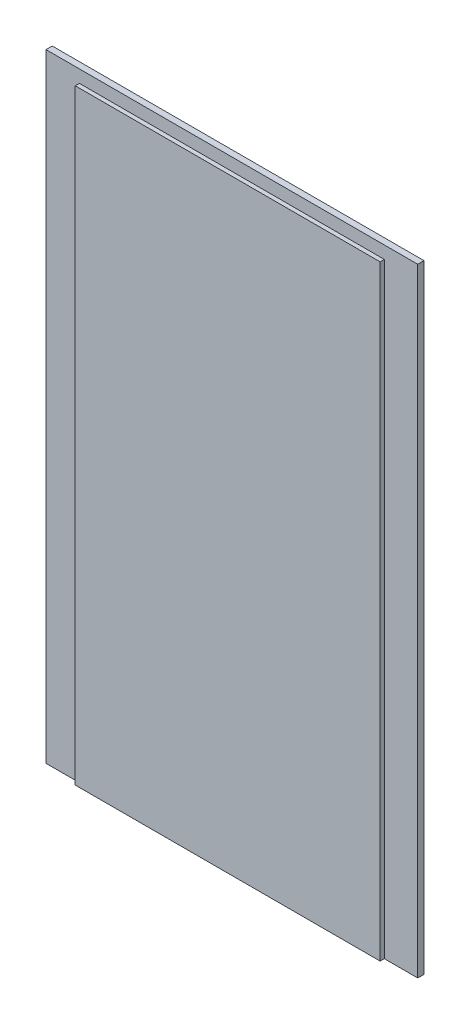
from build123d import *

# Parameters (mm, degrees)
EXTRUDE_1_DEPTH = 145
SKETCH_6_W      = 89
SKETCH_6_H      = 1.5
EXTRUDE_2_DEPTH = 3
SKETCH_7_W      = 0.897435897
SKETCH_7_H      = 3.5
SKETCH_7_W_2    = 0.897435898
EXTRUDE_3_DEPTH = 3


with BuildPart() as part:
    # Эскиз5 → Бобышка-Вытянуть1 (new body)
    with BuildSketch(Plane(origin=(0, 0, 0), x_dir=(1, 0, 0), z_dir=(0, 1, 0))):
        Polygon((36.5, 3.5), (-36.5, 3.5), (-36.5, 2.5), (-44.5, 2.5), (-44.5, 1), (-36.5, 1), (-36.5, 0), (36.5, 0), (36.5, 1), (44.5, 1), (44.5, 2.5), (36.5, 2.5), align=None)
    extrude(amount=EXTRUDE_1_DEPTH)

    # Эскиз6 → Бобышка-Вытянуть2 (add)
    with BuildSketch(Plane(origin=(0, 145, 0), x_dir=(1, 0, 0), z_dir=(0, 1, 0))):
        with Locations((0, 1.75)):
            Rectangle(SKETCH_6_W, SKETCH_6_H)
    extrude(amount=EXTRUDE_2_DEPTH)

    # Эскиз7 → Бобышка-Вытянуть3 (add)
    # profile 1 of 29: a face of its own
    with BuildSketch(Plane(origin=(0, 0, -3.5), x_dir=(-1, 0, 0), z_dir=(0, 0, -1))):
        Polygon((6.340945513, 69), (5.374098558, 69), (4.307692308, 71.44130609), (3.234975962, 69), (2.275140224, 69), (1.548076923, 72.5), (2.457431891, 72.5), (2.916666667, 70.289362981), (3.888421474, 72.5), (4.732572115, 72.5), (5.698717949, 70.289362981), (6.157251603, 72.5), (7.067307692, 72.5), align=None)
    # profile 2 of 29: a face of its own
    with BuildSketch(Plane(origin=(0, 0, -3.5), x_dir=(-1, 0, 0), z_dir=(0, 0, -1))):
        with Locations((0.336538461, 70.75)):
            Rectangle(SKETCH_7_W, SKETCH_7_H)
    # profile 3 of 29: a face of its own
    with BuildSketch(Plane(origin=(0, 0, -3.5), x_dir=(-1, 0, 0), z_dir=(0, 0, -1))):
        with BuildLine():
            Line((-1.189102564, 69), (-2.165064103, 69))
            add(Edge.make_bspline(
                [(-2.165064103, 69), (-2.228635261, 69.00020437), (-2.351357975, 69.000598903), (-2.528562634, 69.005416294), (-2.692177155, 69.013957561), (-2.842104158, 69.024639346), (-2.978162429, 69.03946478), (-3.100370519, 69.056481913), (-3.208787397, 69.077306359), (-3.304826613, 69.101873952), (-3.391368879, 69.130907486), (-3.472520026, 69.162052171), (-3.548524285, 69.198473839), (-3.61980905, 69.238774368), (-3.686789633, 69.282246677), (-3.74931433, 69.329862159), (-3.806984201, 69.381932528), (-3.859662346, 69.437885814), (-3.906236926, 69.497608324), (-3.948563722, 69.559227105), (-3.982424958, 69.625095846), (-4.011836623, 69.692975425), (-4.033059597, 69.764437317), (-4.049787365, 69.838349293), (-4.058506818, 69.915458372), (-4.060095018, 69.967763964), (-4.060897436, 69.994190705)],
                knots=[0, 0, 0, 0, 1.900408557, 3.668696642, 5.298733665, 6.798040708, 8.16136036, 9.389513719, 10.485676558, 11.460051565, 12.350426071, 13.213208427, 14.056969626, 14.867235364, 15.659807379, 16.442338586, 17.214034585, 17.980175887, 18.736345016, 19.476562789, 20.210987823, 20.946740932, 21.684878556, 22.435865721, 23.209740898, 24, 24, 24, 24], degree=3))
            add(Edge.make_bspline(
                [(-4.060897436, 69.994190705), (-4.060107465, 70.023447976), (-4.058551519, 70.081073787), (-4.045717785, 70.165504319), (-4.024375289, 70.245952319), (-3.995855212, 70.323199553), (-3.957535253, 70.396003671), (-3.911675105, 70.465653093), (-3.856683337, 70.530626699), (-3.793786521, 70.591877287), (-3.723945337, 70.648850029), (-3.647932205, 70.701910234), (-3.565279033, 70.749016356), (-3.477896321, 70.794000478), (-3.383273212, 70.831679235), (-3.283697862, 70.867282699), (-3.177800027, 70.897360113), (-3.104663932, 70.913070651), (-3.067407853, 70.921073718)],
                knots=[0, 0, 0, 0, 0.947621555, 1.86645774, 2.759084883, 3.640919322, 4.528263458, 5.418736085, 6.337853046, 7.280286935, 8.259540735, 9.255198587, 10.279917928, 11.339871244, 12.43669861, 13.576668726, 14.765536754, 16, 16, 16, 16], degree=3))
            add(Edge.make_bspline(
                [(-3.067407853, 70.921073718), (-3.042673898, 70.925539616), (-2.988977895, 70.935234827), (-2.900664245, 70.945052875), (-2.798740793, 70.954048862), (-2.683038007, 70.961811102), (-2.553516703, 70.967091734), (-2.410243225, 70.971199744), (-2.25295044, 70.974201348), (-2.143564576, 70.974304959), (-2.086538462, 70.974358974)],
                knots=[0, 0, 0, 0, 0.613221355, 1.331268544, 2.167268072, 3.11042782, 4.160855784, 5.330565642, 6.608344223, 8, 8, 8, 8], degree=3))
            Line((-2.086538462, 70.974358974), (-2.086538462, 72.5))
            Line((-2.086538462, 72.5), (-1.189102564, 72.5))
            Line((-1.189102564, 72.5), (-1.189102564, 69))
        make_face()
        with BuildLine():
            Line((-2.086538462, 70.346153846), (-2.383112981, 70.346153846))
            add(Edge.make_bspline(
                [(-2.383112981, 70.346153846), (-2.411158218, 70.345962385), (-2.46514861, 70.345593799), (-2.542755585, 70.344388739), (-2.61383255, 70.341702152), (-2.678085373, 70.337300055), (-2.735666434, 70.332832713), (-2.786349517, 70.326253381), (-2.830671994, 70.319651451), (-2.879967142, 70.30874307), (-2.93381556, 70.291242699), (-2.991426546, 70.264259758), (-3.042595004, 70.232332582), (-3.085538583, 70.193476578), (-3.120296427, 70.150065849), (-3.145634353, 70.101886118), (-3.160805746, 70.049085389), (-3.162563664, 70.012285503), (-3.163461538, 69.993489583)],
                knots=[0, 0, 0, 0, 1.407758276, 2.710100819, 3.895851713, 4.977388327, 5.942821687, 6.794020387, 7.542320152, 8.191242121, 9.326416202, 10.375988675, 11.378278205, 12.341785334, 13.268824292, 14.15557569, 15.057941327, 16, 16, 16, 16], degree=3))
            add(Edge.make_bspline(
                [(-3.163461538, 69.993489583), (-3.162851565, 69.977059925), (-3.16166178, 69.945012985), (-3.150525145, 69.899015888), (-3.134033951, 69.855888178), (-3.108480768, 69.817261279), (-3.077837345, 69.780836435), (-3.038861195, 69.74964819), (-2.994613049, 69.719941175), (-2.960889693, 69.705266351), (-2.943309295, 69.697616186)],
                knots=[0, 0, 0, 0, 1.000089897, 1.950729556, 2.871637391, 3.80066878, 4.760556227, 5.762269319, 6.833443624, 8, 8, 8, 8], degree=3))
            add(Edge.make_bspline(
                [(-2.943309295, 69.697616186), (-2.928677051, 69.691964447), (-2.89711002, 69.679771605), (-2.843924022, 69.666277432), (-2.78233594, 69.654546484), (-2.712342845, 69.64495998), (-2.633994156, 69.637348407), (-2.547018318, 69.631642407), (-2.451366931, 69.629351778), (-2.384749174, 69.628597013), (-2.350160256, 69.628205128)],
                knots=[0, 0, 0, 0, 0.626675799, 1.351965855, 2.189441299, 3.132954783, 4.175220124, 5.336285959, 6.616960563, 8, 8, 8, 8], degree=3))
            Line((-2.350160256, 69.628205128), (-2.086538462, 69.628205128))
            Line((-2.086538462, 69.628205128), (-2.086538462, 70.346153846))
        make_face(mode=Mode.SUBTRACT)
    # profile 4 of 29: a face of its own
    with BuildSketch(Plane(origin=(0, 0, -3.5), x_dir=(-1, 0, 0), z_dir=(0, 0, -1))):
        Polygon((-4.46474359, 69), (-7.067307692, 69), (-7.067307692, 69.628205128), (-6.21474359, 69.628205128), (-6.21474359, 72.5), (-5.317307692, 72.5), (-5.317307692, 69.628205128), (-4.46474359, 69.628205128), align=None)
    # profile 5 of 29: a face of its own
    with BuildSketch(Plane(origin=(0, 0, -3.5), x_dir=(-1, 0, 0), z_dir=(0, 0, -1))):
        with BuildLine():
            Line((12.474358974, 76.485376603), (13.096254006, 76.92568109))
            add(Edge.make_bspline(
                [(13.096254006, 76.92568109), (13.149405771, 76.885110595), (13.254326787, 76.805024872), (13.420542505, 76.700698766), (13.592376747, 76.613664551), (13.768940381, 76.541818562), (13.950409291, 76.485314643), (14.136960119, 76.445526477), (14.328393483, 76.420840909), (14.457758288, 76.418066604), (14.523036859, 76.416666667)],
                knots=[0, 0, 0, 0, 1.038268964, 2.04953188, 3.04312578, 4.026674873, 5.007265049, 5.991276296, 6.986381084, 8, 8, 8, 8], degree=3))
            add(Edge.make_bspline(
                [(14.523036859, 76.416666667), (14.577761866, 76.417776798), (14.685350397, 76.419959298), (14.843369804, 76.436165416), (14.994732547, 76.463603018), (15.139457694, 76.501311407), (15.277709235, 76.549804263), (15.409267825, 76.609364596), (15.533745459, 76.680811684), (15.650941984, 76.761251841), (15.757195355, 76.850326721), (15.851603052, 76.944511578), (15.931587684, 77.044418502), (15.996362312, 77.150034361), (16.046956645, 77.260676137), (16.082536738, 77.376389478), (16.105287977, 77.497139047), (16.107735154, 77.579491932), (16.108974359, 77.62119391)],
                knots=[0, 0, 0, 0, 1.187810515, 2.335217395, 3.443744067, 4.524122415, 5.57827598, 6.620360632, 7.654213211, 8.689931166, 9.701932281, 10.659736972, 11.5803843, 12.473085625, 13.342609221, 14.213906934, 15.095555492, 16, 16, 16, 16], degree=3))
            add(Edge.make_bspline(
                [(16.108974359, 77.62119391), (16.108179187, 77.650423928), (16.106610477, 77.708088698), (16.097818358, 77.793326481), (16.080939724, 77.875828167), (16.060058263, 77.956402559), (16.030587763, 78.033999043), (15.995706604, 78.109150166), (15.953956132, 78.181709861), (15.906213702, 78.251646636), (15.853230107, 78.319060472), (15.793890593, 78.382112585), (15.729940026, 78.44181143), (15.661169847, 78.498248279), (15.586388321, 78.550120896), (15.506381945, 78.598281529), (15.421447675, 78.643597011), (15.331057431, 78.683404178), (15.237688824, 78.721156245), (15.140618197, 78.75197842), (15.041718523, 78.780083267), (14.939660424, 78.801141812), (14.835470835, 78.81926025), (14.728411842, 78.830487251), (14.618993655, 78.838981195), (14.545023048, 78.839487516), (14.507612179, 78.83974359)],
                knots=[0, 0, 0, 0, 0.9376715, 1.849831607, 2.74357491, 3.636311886, 4.516213089, 5.40146135, 6.291172518, 7.19758658, 8.115334337, 9.03808814, 9.971435783, 10.919652956, 11.888617217, 12.887416778, 13.913407831, 14.973546859, 16.053635784, 17.141602244, 18.238132767, 19.349523208, 20.481945609, 21.628346475, 22.800528716, 24, 24, 24, 24], degree=3))
            add(Edge.make_bspline(
                [(14.507612179, 78.83974359), (14.444454977, 78.838396222), (14.320609121, 78.835754151), (14.138857661, 78.815013237), (13.965373976, 78.781177234), (13.826359122, 78.739960985), (13.717473026, 78.699916327), (13.63440187, 78.663590392), (13.54908447, 78.622536716), (13.462032767, 78.575153818), (13.37272731, 78.522625257), (13.282113895, 78.463607715), (13.189045491, 78.399571431), (13.127212021, 78.354041028), (13.095552885, 78.330729167)],
                knots=[0, 0, 0, 0, 1.483770936, 2.909547549, 4.292426947, 5.632183673, 6.311578283, 7.017531894, 7.761751139, 8.53576674, 9.34574804, 10.195735624, 11.076204957, 12, 12, 12, 12], degree=3))
            Line((13.095552885, 78.330729167), (12.493289263, 78.799779647))
            add(Edge.make_bspline(
                [(12.493289263, 78.799779647), (12.535865916, 78.830202581), (12.619634385, 78.89005892), (12.746441515, 78.973617835), (12.872267333, 79.049044046), (12.995301011, 79.118797951), (13.116799082, 79.180905347), (13.236984169, 79.234455097), (13.354646299, 79.282932784), (13.47219216, 79.322763774), (13.590668639, 79.357874568), (13.712516947, 79.386744475), (13.838227208, 79.412402047), (13.96791673, 79.432252804), (14.101612664, 79.448800497), (14.239416278, 79.459470203), (14.381326343, 79.466998199), (14.4772198, 79.467628919), (14.525841346, 79.467948718)],
                knots=[0, 0, 0, 0, 1.151115548, 2.264790175, 3.339609904, 4.377801964, 5.375697708, 6.339873563, 7.271677484, 8.174039226, 9.068826305, 9.989098544, 10.927812609, 11.890561843, 12.874533522, 13.890697936, 14.930505465, 16, 16, 16, 16], degree=3))
            add(Edge.make_bspline(
                [(14.525841346, 79.467948718), (14.614700724, 79.4662666), (14.788773241, 79.462971387), (15.043755613, 79.439137362), (15.286299135, 79.39862166), (15.516385041, 79.342031539), (15.734050974, 79.268945495), (15.939530767, 79.179967174), (16.13258764, 79.074226564), (16.283156382, 78.973197848), (16.395493867, 78.885198364), (16.474474983, 78.816997038), (16.547707411, 78.746310925), (16.616321929, 78.673993868), (16.678867345, 78.598827771), (16.735405461, 78.521073184), (16.787030468, 78.441333389), (16.83336625, 78.359480416), (16.873866473, 78.274979174), (16.910128003, 78.188924198), (16.939274103, 78.099875627), (16.964078815, 78.008921821), (16.982652399, 77.915386385), (16.997150498, 77.819998104), (17.004597129, 77.72204171), (17.005800738, 77.656026763), (17.006410256, 77.622596154)],
                knots=[0, 0, 0, 0, 1.854242412, 3.632398211, 5.338628587, 6.981657757, 8.571767065, 10.124763514, 11.648247808, 13.15920557, 13.902647685, 14.625273405, 15.335833078, 16.025877133, 16.704660648, 17.374839119, 18.030956841, 18.686113137, 19.336148312, 19.985561112, 20.633323558, 21.289930521, 21.951823402, 22.622250278, 23.302294172, 24, 24, 24, 24], degree=3))
            add(Edge.make_bspline(
                [(17.006410256, 77.622596154), (17.005456915, 77.579556797), (17.00356531, 77.494158793), (16.988770496, 77.367881986), (16.963165616, 77.245642951), (16.928958961, 77.126741352), (16.883746709, 77.012062311), (16.829737815, 76.900342164), (16.764697183, 76.793005529), (16.690572981, 76.689238538), (16.606529887, 76.59038537), (16.514877935, 76.49556231), (16.414023267, 76.406112407), (16.30422532, 76.322475396), (16.187139919, 76.241850095), (16.060319097, 76.167734996), (15.9250815, 76.098619097), (15.782608563, 76.034454866), (15.63474017, 75.976119162), (15.482476776, 75.926963807), (15.327994579, 75.883820543), (15.170576514, 75.848434552), (15.010098129, 75.82246995), (14.846916875, 75.802223332), (14.680939976, 75.791273443), (14.569324939, 75.789402151), (14.513221154, 75.788461538)],
                knots=[0, 0, 0, 0, 0.901853117, 1.78944255, 2.659714495, 3.516835198, 4.379076333, 5.239939207, 6.114349796, 7.00597059, 7.90964393, 8.830983393, 9.767712282, 10.731677408, 11.722021095, 12.745140691, 13.807530144, 14.903594606, 16.018677386, 17.136950282, 18.255126642, 19.379240575, 20.51618145, 21.66072434, 22.824152899, 24, 24, 24, 24], degree=3))
            add(Edge.make_bspline(
                [(14.513221154, 75.788461538), (14.465064095, 75.788984737), (14.369377411, 75.790024317), (14.226483546, 75.798872128), (14.084895504, 75.812458096), (13.944684855, 75.833291948), (13.805690209, 75.858310593), (13.668021882, 75.88897265), (13.532144751, 75.926619939), (13.397659593, 75.968200301), (13.266421275, 76.015726232), (13.139347856, 76.06827703), (13.016999859, 76.12589293), (12.899319083, 76.188522438), (12.785555935, 76.254585148), (12.677327717, 76.326737398), (12.57314342, 76.402896672), (12.507260244, 76.457905735), (12.474358974, 76.485376603)],
                knots=[0, 0, 0, 0, 1.050930545, 2.088168614, 3.123536348, 4.154333288, 5.180817913, 6.20542527, 7.231212662, 8.257240971, 9.27696146, 10.276297078, 11.257425369, 12.227151396, 13.185054345, 14.127224728, 15.064758453, 16, 16, 16, 16], degree=3))
        make_face()
    # profile 6 of 29: a face of its own
    with BuildSketch(Plane(origin=(0, 0, -3.5), x_dir=(-1, 0, 0), z_dir=(0, 0, -1))):
        with BuildLine():
            add(Edge.make_bspline(
                [(9.323517628, 75.788461538), (9.24095194, 75.790017755), (9.078462855, 75.793080386), (8.839179837, 75.819073329), (8.608700132, 75.860741058), (8.386853461, 75.919794254), (8.174016879, 75.99571736), (7.969435905, 76.087725356), (7.77415525, 76.197515485), (7.619864293, 76.302421546), (7.502941431, 76.392919469), (7.420739857, 76.463041113), (7.344429822, 76.5353162), (7.273201846, 76.60895738), (7.208108423, 76.684740501), (7.148201716, 76.762034273), (7.093908597, 76.8411537), (7.046554141, 76.922916121), (7.003355998, 77.005701114), (6.9660088, 77.090604995), (6.935318175, 77.177682327), (6.910135647, 77.266493407), (6.889424191, 77.356716377), (6.875695999, 77.44908209), (6.866946203, 77.543198735), (6.865908357, 77.606684364), (6.865384615, 77.638721955)],
                knots=[0, 0, 0, 0, 1.74493956, 3.434037043, 5.081349706, 6.691931204, 8.281094076, 9.853178973, 11.428048157, 13.010685739, 13.792349565, 14.552725307, 15.293608286, 16.013370378, 16.717482666, 17.404257924, 18.079800099, 18.744084574, 19.400329141, 20.052937459, 20.702960141, 21.350349162, 22.003555586, 22.658236246, 23.322888033, 24, 24, 24, 24], degree=3))
            add(Edge.make_bspline(
                [(6.865384615, 77.638721955), (6.865920376, 77.670290692), (6.866985873, 77.733073118), (6.875626955, 77.826276535), (6.889669261, 77.917820477), (6.909177881, 78.007562343), (6.93470429, 78.095224622), (6.964672791, 78.181425628), (7.00133557, 78.265371293), (7.043365703, 78.347641521), (7.091544264, 78.427541441), (7.143848446, 78.506528913), (7.202994004, 78.58285033), (7.267883606, 78.657010724), (7.337103143, 78.730530071), (7.413303309, 78.800758513), (7.493802868, 78.870801891), (7.609801607, 78.959786424), (7.762286028, 79.064102381), (7.956486653, 79.172222411), (8.160192136, 79.263593278), (8.372945399, 79.3390939), (8.59583992, 79.395960552), (8.827645601, 79.438505448), (9.069415006, 79.463034384), (9.23371986, 79.466292953), (9.317207532, 79.467948718)],
                knots=[0, 0, 0, 0, 0.670509522, 1.333477928, 1.986463641, 2.636953425, 3.282746882, 3.924942789, 4.574218971, 5.226997055, 5.88599427, 6.555179182, 7.238360871, 7.935169854, 8.64801199, 9.382112235, 10.13545024, 10.913984185, 12.486487991, 14.055571225, 15.628803686, 17.224104116, 18.84486328, 20.510026804, 22.226651662, 24, 24, 24, 24], degree=3))
            add(Edge.make_bspline(
                [(9.317207532, 79.467948718), (9.361386892, 79.467564804), (9.448622841, 79.466806733), (9.578156772, 79.460163947), (9.704749461, 79.450161436), (9.828569746, 79.434138203), (9.949561051, 79.415633486), (10.067994883, 79.392542239), (10.183124802, 79.364233124), (10.295892462, 79.333080956), (10.40539431, 79.29616093), (10.512454741, 79.255887117), (10.616478551, 79.210769593), (10.717582573, 79.161727661), (10.81593062, 79.108147889), (10.911873047, 79.051029501), (11.004621178, 78.989041435), (11.093865421, 78.923393557), (11.179271232, 78.855139493), (11.259062049, 78.783986067), (11.33425909, 78.712272809), (11.40326693, 78.638062943), (11.467040482, 78.562581489), (11.525367595, 78.485370127), (11.578059367, 78.406733845), (11.625374156, 78.326562504), (11.666633521, 78.244505677), (11.702579477, 78.160954819), (11.732592544, 78.075814099), (11.758127155, 77.989335939), (11.777942846, 77.901074084), (11.79073971, 77.811012739), (11.799776465, 77.719533708), (11.800777017, 77.65790855), (11.801282051, 77.626802885)],
                knots=[0, 0, 0, 0, 1.237847268, 2.444236017, 3.63360164, 4.795130255, 5.941758047, 7.062951849, 8.174773718, 9.263206711, 10.340053451, 11.41157047, 12.467505574, 13.51602308, 14.55921001, 15.604799062, 16.643701838, 17.683677307, 18.708449217, 19.705842561, 20.678441117, 21.619007911, 22.543849975, 23.446255201, 24.328961177, 25.194892346, 26.052987999, 26.90082716, 27.741759166, 28.58103215, 29.426287742, 30.273696855, 31.128638194, 32, 32, 32, 32], degree=3))
            add(Edge.make_bspline(
                [(11.801282051, 77.626802885), (11.800391797, 77.585390617), (11.798620098, 77.502975925), (11.782741347, 77.380705102), (11.756575224, 77.261205371), (11.721034365, 77.143838439), (11.673146709, 77.029770388), (11.617557546, 76.916768803), (11.549507844, 76.807601929), (11.472637634, 76.701064483), (11.386228916, 76.599029382), (11.292297004, 76.50136961), (11.190317223, 76.40938267), (11.080635651, 76.323062022), (10.963194729, 76.242061533), (10.837421251, 76.16756514), (10.704761034, 76.09708828), (10.565215546, 76.033022181), (10.420219854, 75.975823779), (10.272034435, 75.925196768), (10.120542199, 75.882981987), (9.966427267, 75.849098842), (9.809825086, 75.821065724), (9.650100363, 75.802864916), (9.487789815, 75.790056574), (9.378464464, 75.788995056), (9.323517628, 75.788461538)],
                knots=[0, 0, 0, 0, 0.873460711, 1.738277099, 2.596163496, 3.452461267, 4.321456688, 5.203532137, 6.106744663, 7.031925761, 7.973272717, 8.925304006, 9.888873028, 10.868446012, 11.868274739, 12.89658803, 13.950947263, 15.036473622, 16.13434976, 17.23835449, 18.33901757, 19.450408571, 20.566700231, 21.693916212, 22.840964104, 24, 24, 24, 24], degree=3))
        make_face()
        with BuildLine():
            add(Edge.make_bspline(
                [(9.336838942, 76.416666667), (9.39110197, 76.417743258), (9.497536018, 76.419854935), (9.653814546, 76.436473033), (9.803721345, 76.462669882), (9.946963405, 76.500655317), (10.083506237, 76.549054601), (10.213412393, 76.608119737), (10.336353122, 76.678685977), (10.452091343, 76.758505788), (10.55740848, 76.846865498), (10.650326629, 76.941806876), (10.728274695, 77.043229576), (10.793344949, 77.149765933), (10.842392169, 77.263253588), (10.878395614, 77.381942044), (10.899990355, 77.506828309), (10.902545131, 77.591895666), (10.903846154, 77.635216346)],
                knots=[0, 0, 0, 0, 1.178028087, 2.310639573, 3.408615578, 4.479507672, 5.524413559, 6.550856868, 7.573693561, 8.598492218, 9.599763625, 10.554372239, 11.477031471, 12.371703975, 13.257960676, 14.153783811, 15.059811607, 16, 16, 16, 16], degree=3))
            add(Edge.make_bspline(
                [(10.903846154, 77.635216346), (10.902105714, 77.683253305), (10.898681974, 77.777750158), (10.871336289, 77.915327804), (10.826921228, 78.045489234), (10.763935651, 78.167488597), (10.682947462, 78.281676019), (10.58355008, 78.38701422), (10.467241606, 78.485418595), (10.379646882, 78.541586256), (10.334535256, 78.570512821)],
                knots=[0, 0, 0, 0, 1.002334352, 1.971761834, 2.916169619, 3.865506182, 4.828130753, 5.82934798, 6.882105733, 8, 8, 8, 8], degree=3))
            add(Edge.make_bspline(
                [(10.334535256, 78.570512821), (10.297468619, 78.592160507), (10.223185512, 78.635543385), (10.105799764, 78.689547929), (9.984814331, 78.736238222), (9.859647625, 78.77407567), (9.730544582, 78.803471911), (9.597277608, 78.824489812), (9.460024601, 78.837373433), (9.367015163, 78.838947912), (9.320012019, 78.83974359)],
                knots=[0, 0, 0, 0, 0.968643878, 1.941203282, 2.913290218, 3.894783287, 4.890638372, 5.900389362, 6.938943154, 8, 8, 8, 8], degree=3))
            add(Edge.make_bspline(
                [(9.320012019, 78.83974359), (9.267156588, 78.838626759), (9.163065829, 78.836427331), (9.00992903, 78.820237208), (8.862834214, 78.792609743), (8.721256523, 78.755413361), (8.586452084, 78.704696128), (8.456707466, 78.645564503), (8.333482763, 78.574074442), (8.217543879, 78.492974195), (8.11158974, 78.40395408), (8.017898006, 78.309329885), (7.940051483, 78.208206514), (7.874315715, 78.103367136), (7.823996241, 77.992297772), (7.789557034, 77.875893678), (7.766392748, 77.754853027), (7.764023542, 77.672251622), (7.762820513, 77.630308494)],
                knots=[0, 0, 0, 0, 1.159370508, 2.283204438, 3.373189917, 4.440206262, 5.489687815, 6.528799886, 7.564681923, 8.610060713, 9.628826744, 10.596804913, 11.524873573, 12.422640022, 13.306018849, 14.189918207, 15.080881349, 16, 16, 16, 16], degree=3))
            add(Edge.make_bspline(
                [(7.762820513, 77.630308494), (7.764053118, 77.588603229), (7.76648726, 77.506243853), (7.789333996, 77.385541839), (7.824585865, 77.269557502), (7.876614308, 77.159430962), (7.939947263, 77.052559934), (8.020486547, 76.952287637), (8.11425488, 76.856555877), (8.221107649, 76.767024002), (8.337734278, 76.684816057), (8.462432595, 76.613478135), (8.592573733, 76.551504198), (8.729842672, 76.503047431), (8.872789714, 76.464280794), (9.021806133, 76.436044151), (9.177328995, 76.419995079), (9.283049944, 76.417789054), (9.336838942, 76.416666667)],
                knots=[0, 0, 0, 0, 0.907242178, 1.791617892, 2.665610744, 3.539944272, 4.437111569, 5.364594011, 6.332611592, 7.351015874, 8.395753995, 9.435336014, 10.47567752, 11.530001558, 12.600280703, 13.698150426, 14.82885857, 16, 16, 16, 16], degree=3))
        make_face(mode=Mode.SUBTRACT)
    # profile 7 of 29: a face of its own
    with BuildSketch(Plane(origin=(0, 0, -3.5), x_dir=(-1, 0, 0), z_dir=(0, 0, -1))):
        Polygon((2.836738782, 79.378205128), (4.195512821, 76.812099359), (5.554987981, 79.378205128), (6.517628205, 79.378205128), (4.657552083, 75.878205128), (3.736278045, 75.878205128), (1.873397436, 79.378205128), align=None)
    # profile 8 of 29: a face of its own
    with BuildSketch(Plane(origin=(0, 0, -3.5), x_dir=(-1, 0, 0), z_dir=(0, 0, -1))):
        with BuildLine():
            add(Edge.make_bspline(
                [(-0.907251603, 75.788461538), (-0.989817291, 75.790017755), (-1.152306376, 75.793080386), (-1.391589394, 75.819073329), (-1.622069099, 75.860741058), (-1.84391577, 75.919794254), (-2.056752351, 75.99571736), (-2.261333326, 76.087725356), (-2.45661398, 76.197515485), (-2.610904938, 76.302421546), (-2.7278278, 76.392919469), (-2.810029374, 76.463041113), (-2.886339409, 76.5353162), (-2.957567385, 76.60895738), (-3.022660808, 76.684740501), (-3.082567515, 76.762034273), (-3.136860634, 76.8411537), (-3.18421509, 76.922916121), (-3.227413233, 77.005701114), (-3.26476043, 77.090604995), (-3.295451056, 77.177682327), (-3.320633584, 77.266493407), (-3.34134504, 77.356716377), (-3.355073232, 77.44908209), (-3.363823028, 77.543198735), (-3.364860874, 77.606684364), (-3.365384615, 77.638721955)],
                knots=[0, 0, 0, 0, 1.74493956, 3.434037043, 5.081349706, 6.691931204, 8.281094076, 9.853178973, 11.428048157, 13.010685739, 13.792349565, 14.552725307, 15.293608286, 16.013370378, 16.717482666, 17.404257924, 18.079800099, 18.744084574, 19.400329141, 20.052937459, 20.702960141, 21.350349162, 22.003555586, 22.658236246, 23.322888033, 24, 24, 24, 24], degree=3))
            add(Edge.make_bspline(
                [(-3.365384615, 77.638721955), (-3.364848854, 77.670290692), (-3.363783358, 77.733073118), (-3.355142276, 77.826276535), (-3.341099969, 77.917820477), (-3.32159135, 78.007562343), (-3.296064941, 78.095224622), (-3.26609644, 78.181425628), (-3.229433661, 78.265371293), (-3.187403527, 78.347641521), (-3.139224967, 78.427541441), (-3.086920785, 78.506528913), (-3.027775226, 78.58285033), (-2.962885625, 78.657010724), (-2.893666088, 78.730530071), (-2.817465922, 78.800758513), (-2.736966362, 78.870801891), (-2.620967624, 78.959786424), (-2.468483202, 79.064102381), (-2.274282577, 79.172222411), (-2.070577095, 79.263593278), (-1.857823832, 79.3390939), (-1.63492931, 79.395960552), (-1.40312363, 79.438505448), (-1.161354225, 79.463034384), (-0.997049371, 79.466292953), (-0.913561699, 79.467948718)],
                knots=[0, 0, 0, 0, 0.670509522, 1.333477928, 1.986463641, 2.636953425, 3.282746882, 3.924942789, 4.574218971, 5.226997055, 5.88599427, 6.555179182, 7.238360871, 7.935169854, 8.64801199, 9.382112235, 10.13545024, 10.913984185, 12.486487991, 14.055571225, 15.628803686, 17.224104116, 18.84486328, 20.510026804, 22.226651662, 24, 24, 24, 24], degree=3))
            add(Edge.make_bspline(
                [(-0.913561699, 79.467948718), (-0.869382339, 79.467564804), (-0.78214639, 79.466806733), (-0.652612459, 79.460163947), (-0.526019769, 79.450161436), (-0.402199485, 79.434138203), (-0.28120818, 79.415633486), (-0.162774348, 79.392542239), (-0.047644429, 79.364233124), (0.065123231, 79.333080956), (0.174625079, 79.29616093), (0.28168551, 79.255887117), (0.38570932, 79.210769593), (0.486813342, 79.161727661), (0.585161389, 79.108147889), (0.681103816, 79.051029501), (0.773851947, 78.989041435), (0.86309619, 78.923393557), (0.948502002, 78.855139493), (1.028292818, 78.783986067), (1.103489859, 78.712272809), (1.172497699, 78.638062943), (1.236271251, 78.562581489), (1.294598364, 78.485370127), (1.347290137, 78.406733845), (1.394604925, 78.326562504), (1.43586429, 78.244505677), (1.471810246, 78.160954819), (1.501823313, 78.075814099), (1.527357924, 77.989335939), (1.547173615, 77.901074084), (1.559970479, 77.811012739), (1.569007234, 77.719533708), (1.570007786, 77.65790855), (1.570512821, 77.626802885)],
                knots=[0, 0, 0, 0, 1.237847268, 2.444236017, 3.63360164, 4.795130255, 5.941758047, 7.062951849, 8.174773718, 9.263206711, 10.340053451, 11.41157047, 12.467505574, 13.51602308, 14.55921001, 15.604799062, 16.643701838, 17.683677307, 18.708449217, 19.705842561, 20.678441117, 21.619007911, 22.543849975, 23.446255201, 24.328961177, 25.194892346, 26.052987999, 26.90082716, 27.741759166, 28.58103215, 29.426287742, 30.273696855, 31.128638194, 32, 32, 32, 32], degree=3))
            add(Edge.make_bspline(
                [(1.570512821, 77.626802885), (1.569622566, 77.585390617), (1.567850867, 77.502975925), (1.551972116, 77.380705102), (1.525805993, 77.261205371), (1.490265135, 77.143838439), (1.442377478, 77.029770388), (1.386788315, 76.916768803), (1.318738613, 76.807601929), (1.241868403, 76.701064483), (1.155459685, 76.599029382), (1.061527773, 76.50136961), (0.959547992, 76.40938267), (0.84986642, 76.323062022), (0.732425498, 76.242061533), (0.60665202, 76.16756514), (0.473991803, 76.09708828), (0.334446315, 76.033022181), (0.189450623, 75.975823779), (0.041265204, 75.925196768), (-0.110227032, 75.882981987), (-0.264341964, 75.849098842), (-0.420944145, 75.821065724), (-0.580668867, 75.802864916), (-0.742979416, 75.790056574), (-0.852304767, 75.788995056), (-0.907251603, 75.788461538)],
                knots=[0, 0, 0, 0, 0.873460711, 1.738277099, 2.596163496, 3.452461267, 4.321456688, 5.203532137, 6.106744663, 7.031925761, 7.973272717, 8.925304006, 9.888873028, 10.868446012, 11.868274739, 12.89658803, 13.950947263, 15.036473622, 16.13434976, 17.23835449, 18.33901757, 19.450408571, 20.566700231, 21.693916212, 22.840964104, 24, 24, 24, 24], degree=3))
        make_face()
        with BuildLine():
            add(Edge.make_bspline(
                [(-0.893930288, 76.416666667), (-0.839667261, 76.417743258), (-0.733233213, 76.419854935), (-0.576954684, 76.436473033), (-0.427047886, 76.462669882), (-0.283805826, 76.500655317), (-0.147262993, 76.549054601), (-0.017356838, 76.608119737), (0.105583891, 76.678685977), (0.221322112, 76.758505788), (0.326639249, 76.846865498), (0.419557398, 76.941806876), (0.497505464, 77.043229576), (0.562575718, 77.149765933), (0.611622938, 77.263253588), (0.647626383, 77.381942044), (0.669221124, 77.506828309), (0.6717759, 77.591895666), (0.673076923, 77.635216346)],
                knots=[0, 0, 0, 0, 1.178028087, 2.310639573, 3.408615578, 4.479507672, 5.524413559, 6.550856868, 7.573693561, 8.598492218, 9.599763625, 10.554372239, 11.477031471, 12.371703975, 13.257960676, 14.153783811, 15.059811607, 16, 16, 16, 16], degree=3))
            add(Edge.make_bspline(
                [(0.673076923, 77.635216346), (0.671336483, 77.683253305), (0.667912743, 77.777750158), (0.640567058, 77.915327804), (0.596151997, 78.045489234), (0.53316642, 78.167488597), (0.452178231, 78.281676019), (0.352780849, 78.38701422), (0.236472376, 78.485418595), (0.148877651, 78.541586256), (0.103766026, 78.570512821)],
                knots=[0, 0, 0, 0, 1.002334352, 1.971761834, 2.916169619, 3.865506182, 4.828130753, 5.82934798, 6.882105733, 8, 8, 8, 8], degree=3))
            add(Edge.make_bspline(
                [(0.103766026, 78.570512821), (0.066699389, 78.592160507), (-0.007583719, 78.635543385), (-0.124969467, 78.689547929), (-0.245954899, 78.736238222), (-0.371121606, 78.77407567), (-0.500224649, 78.803471911), (-0.633491622, 78.824489812), (-0.77074463, 78.837373433), (-0.863754068, 78.838947912), (-0.910757212, 78.83974359)],
                knots=[0, 0, 0, 0, 0.968643878, 1.941203282, 2.913290218, 3.894783287, 4.890638372, 5.900389362, 6.938943154, 8, 8, 8, 8], degree=3))
            add(Edge.make_bspline(
                [(-0.910757212, 78.83974359), (-0.963612643, 78.838626759), (-1.067703401, 78.836427331), (-1.220840201, 78.820237208), (-1.367935017, 78.792609743), (-1.509512707, 78.755413361), (-1.644317146, 78.704696128), (-1.774061765, 78.645564503), (-1.897286468, 78.574074442), (-2.013225352, 78.492974195), (-2.119179491, 78.40395408), (-2.212871225, 78.309329885), (-2.290717748, 78.208206514), (-2.356453516, 78.103367136), (-2.406772989, 77.992297772), (-2.441212197, 77.875893678), (-2.464376483, 77.754853027), (-2.466745689, 77.672251622), (-2.467948718, 77.630308494)],
                knots=[0, 0, 0, 0, 1.159370508, 2.283204438, 3.373189917, 4.440206262, 5.489687815, 6.528799886, 7.564681923, 8.610060713, 9.628826744, 10.596804913, 11.524873573, 12.422640022, 13.306018849, 14.189918207, 15.080881349, 16, 16, 16, 16], degree=3))
            add(Edge.make_bspline(
                [(-2.467948718, 77.630308494), (-2.466716113, 77.588603229), (-2.464281971, 77.506243853), (-2.441435234, 77.385541839), (-2.406183366, 77.269557502), (-2.354154922, 77.159430962), (-2.290821968, 77.052559934), (-2.210282684, 76.952287637), (-2.116514351, 76.856555877), (-2.009661581, 76.767024002), (-1.893034952, 76.684816057), (-1.768336636, 76.613478135), (-1.638195498, 76.551504198), (-1.500926559, 76.503047431), (-1.357979516, 76.464280794), (-1.208963097, 76.436044151), (-1.053440236, 76.419995079), (-0.947719287, 76.417789054), (-0.893930288, 76.416666667)],
                knots=[0, 0, 0, 0, 0.907242178, 1.791617892, 2.665610744, 3.539944272, 4.437111569, 5.364594011, 6.332611592, 7.351015874, 8.395753995, 9.435336014, 10.47567752, 11.530001558, 12.600280703, 13.698150426, 14.82885857, 16, 16, 16, 16], degree=3))
        make_face(mode=Mode.SUBTRACT)
    # profile 9 of 29: a face of its own
    with BuildSketch(Plane(origin=(0, 0, -3.5), x_dir=(-1, 0, 0), z_dir=(0, 0, -1))):
        Polygon((-4.262820513, 75.878205128), (-5.16025641, 75.878205128), (-5.16025641, 77.224358974), (-6.820512821, 77.224358974), (-6.820512821, 75.878205128), (-7.717948718, 75.878205128), (-7.717948718, 79.378205128), (-6.820512821, 79.378205128), (-6.820512821, 77.852564103), (-5.16025641, 77.852564103), (-5.16025641, 79.378205128), (-4.262820513, 79.378205128), align=None)
    # profile 10 of 29: a face of its own
    with BuildSketch(Plane(origin=(0, 0, -3.5), x_dir=(-1, 0, 0), z_dir=(0, 0, -1))):
        Polygon((-8.794871795, 75.878205128), (-9.692307692, 75.878205128), (-9.692307692, 77.053285256), (-10.995693109, 75.878205128), (-12.150440705, 75.878205128), (-10.433393429, 77.426282051), (-12.317307692, 79.378205128), (-11.219350962, 79.378205128), (-9.692307692, 77.795773237), (-9.692307692, 79.378205128), (-8.794871795, 79.378205128), align=None)
    # profile 11 of 29: a face of its own
    with BuildSketch(Plane(origin=(0, 0, -3.5), x_dir=(-1, 0, 0), z_dir=(0, 0, -1))):
        Polygon((-14.311999199, 75.878205128), (-15.259915865, 75.878205128), (-17.073717949, 79.378205128), (-16.112479968, 79.378205128), (-15.742988782, 78.66025641), (-13.826822917, 78.66025641), (-13.456630609, 79.378205128), (-12.496794872, 79.378205128), align=None)
        Polygon((-14.78525641, 76.817007212), (-14.150040064, 78.032051282), (-15.420472756, 78.032051282), align=None, mode=Mode.SUBTRACT)
    # profile 12 of 29: a face of its own
    with BuildSketch(Plane(origin=(0, 0, -3.5), x_dir=(-1, 0, 0), z_dir=(0, 0, -1))):
        with BuildLine():
            add(Edge.make_bspline(
                [(20.317107372, 82.666666667), (20.234541683, 82.668222883), (20.072052598, 82.671285514), (19.832769581, 82.697278457), (19.602289876, 82.738946186), (19.380443205, 82.797999383), (19.167606623, 82.873922488), (18.963025649, 82.965930484), (18.767744994, 83.075720613), (18.613454036, 83.180626674), (18.496531174, 83.271124597), (18.4143296, 83.341246241), (18.338019565, 83.413521328), (18.26679159, 83.487162508), (18.201698167, 83.562945629), (18.141791459, 83.640239401), (18.087498341, 83.719358828), (18.040143884, 83.80112125), (17.996945742, 83.883906242), (17.959598544, 83.968810124), (17.928907919, 84.055887455), (17.90372539, 84.144698535), (17.883013934, 84.234921505), (17.869285742, 84.327287218), (17.860535946, 84.421403863), (17.859498101, 84.484889492), (17.858974359, 84.516927083)],
                knots=[0, 0, 0, 0, 1.74493956, 3.434037043, 5.081349706, 6.691931204, 8.281094076, 9.853178973, 11.428048157, 13.010685739, 13.792349565, 14.552725307, 15.293608286, 16.013370378, 16.717482666, 17.404257924, 18.079800099, 18.744084574, 19.400329141, 20.052937459, 20.702960141, 21.350349162, 22.003555586, 22.658236246, 23.322888033, 24, 24, 24, 24], degree=3))
            add(Edge.make_bspline(
                [(17.858974359, 84.516927083), (17.85951012, 84.54849582), (17.860575616, 84.611278246), (17.869216698, 84.704481663), (17.883259005, 84.796025605), (17.902767624, 84.885767471), (17.928294033, 84.97342975), (17.958262534, 85.059630756), (17.994925314, 85.143576421), (18.036955447, 85.225846649), (18.085134008, 85.305746569), (18.13743819, 85.384734042), (18.196583748, 85.461055459), (18.261473349, 85.535215852), (18.330692887, 85.608735199), (18.406893053, 85.678963641), (18.487392612, 85.74900702), (18.603391351, 85.837991552), (18.755875772, 85.94230751), (18.950076397, 86.050427539), (19.153781879, 86.141798406), (19.366535142, 86.217299028), (19.589429664, 86.27416568), (19.821235345, 86.316710577), (20.06300475, 86.341239512), (20.227309603, 86.344498081), (20.310797276, 86.346153846)],
                knots=[0, 0, 0, 0, 0.670509522, 1.333477928, 1.986463641, 2.636953425, 3.282746882, 3.924942789, 4.574218971, 5.226997055, 5.88599427, 6.555179182, 7.238360871, 7.935169854, 8.64801199, 9.382112235, 10.13545024, 10.913984185, 12.486487991, 14.055571225, 15.628803686, 17.224104116, 18.84486328, 20.510026804, 22.226651662, 24, 24, 24, 24], degree=3))
            add(Edge.make_bspline(
                [(20.310797276, 86.346153846), (20.354976635, 86.345769932), (20.442212585, 86.345011861), (20.571746515, 86.338369075), (20.698339205, 86.328366564), (20.822159489, 86.312343331), (20.943150794, 86.293838614), (21.061584627, 86.270747367), (21.176714545, 86.242438252), (21.289482206, 86.211286084), (21.398984053, 86.174366058), (21.506044485, 86.134092246), (21.610068295, 86.088974721), (21.711172317, 86.039932789), (21.809520363, 85.986353017), (21.90546279, 85.929234629), (21.998210921, 85.867246564), (22.087455164, 85.801598686), (22.172860976, 85.733344621), (22.252651792, 85.662191196), (22.327848833, 85.590477937), (22.396856674, 85.516268071), (22.460630226, 85.440786617), (22.518957339, 85.363575255), (22.571649111, 85.284938974), (22.618963899, 85.204767632), (22.660223264, 85.122710805), (22.69616922, 85.039159947), (22.726182288, 84.954019227), (22.751716899, 84.867541067), (22.77153259, 84.779279212), (22.784329453, 84.689217867), (22.793366209, 84.597738836), (22.79436676, 84.536113679), (22.794871795, 84.505008013)],
                knots=[0, 0, 0, 0, 1.237847268, 2.444236017, 3.63360164, 4.795130255, 5.941758047, 7.062951849, 8.174773718, 9.263206711, 10.340053451, 11.41157047, 12.467505574, 13.51602308, 14.55921001, 15.604799062, 16.643701838, 17.683677307, 18.708449217, 19.705842561, 20.678441117, 21.619007911, 22.543849975, 23.446255201, 24.328961177, 25.194892346, 26.052987999, 26.90082716, 27.741759166, 28.58103215, 29.426287742, 30.273696855, 31.128638194, 32, 32, 32, 32], degree=3))
            add(Edge.make_bspline(
                [(22.794871795, 84.505008013), (22.79398154, 84.463595746), (22.792209842, 84.381181053), (22.77633109, 84.258910231), (22.750164967, 84.139410499), (22.714624109, 84.022043567), (22.666736452, 83.907975516), (22.611147289, 83.794973932), (22.543097587, 83.685807057), (22.466227378, 83.579269611), (22.37981866, 83.477234511), (22.285886748, 83.379574738), (22.183906967, 83.287587799), (22.074225394, 83.20126715), (21.956784473, 83.120266661), (21.831010994, 83.045770268), (21.698350777, 82.975293408), (21.55880529, 82.91122731), (21.413809597, 82.854028907), (21.265624178, 82.803401896), (21.114131943, 82.761187115), (20.96001701, 82.72730397), (20.803414829, 82.699270852), (20.643690107, 82.681070044), (20.481379559, 82.668261702), (20.372054207, 82.667200185), (20.317107372, 82.666666667)],
                knots=[0, 0, 0, 0, 0.873460711, 1.738277099, 2.596163496, 3.452461267, 4.321456688, 5.203532137, 6.106744663, 7.031925761, 7.973272717, 8.925304006, 9.888873028, 10.868446012, 11.868274739, 12.89658803, 13.950947263, 15.036473622, 16.13434976, 17.23835449, 18.33901757, 19.450408571, 20.566700231, 21.693916212, 22.840964104, 24, 24, 24, 24], degree=3))
        make_face()
        with BuildLine():
            add(Edge.make_bspline(
                [(20.330428686, 83.294871795), (20.384691713, 83.295948386), (20.491125761, 83.298060063), (20.64740429, 83.314678162), (20.797311088, 83.340875011), (20.940553149, 83.378860445), (21.077095981, 83.42725973), (21.207002137, 83.486324865), (21.329942866, 83.556891106), (21.445681086, 83.636710916), (21.550998224, 83.725070626), (21.643916372, 83.820012004), (21.721864439, 83.921434704), (21.786934692, 84.027971061), (21.835981913, 84.141458716), (21.871985358, 84.260147172), (21.893580099, 84.385033437), (21.896134874, 84.470100794), (21.897435897, 84.513421474)],
                knots=[0, 0, 0, 0, 1.178028087, 2.310639573, 3.408615578, 4.479507672, 5.524413559, 6.550856868, 7.573693561, 8.598492218, 9.599763625, 10.554372239, 11.477031471, 12.371703975, 13.257960676, 14.153783811, 15.059811607, 16, 16, 16, 16], degree=3))
            add(Edge.make_bspline(
                [(21.897435897, 84.513421474), (21.895695458, 84.561458433), (21.892271717, 84.655955286), (21.864926032, 84.793532932), (21.820510971, 84.923694362), (21.757525394, 85.045693725), (21.676537205, 85.159881147), (21.577139824, 85.265219348), (21.46083135, 85.363623724), (21.373236625, 85.419791384), (21.328125, 85.448717949)],
                knots=[0, 0, 0, 0, 1.002334352, 1.971761834, 2.916169619, 3.865506182, 4.828130753, 5.82934798, 6.882105733, 8, 8, 8, 8], degree=3))
            add(Edge.make_bspline(
                [(21.328125, 85.448717949), (21.291058363, 85.470365635), (21.216775255, 85.513748514), (21.099389508, 85.567753057), (20.978404075, 85.61444335), (20.853237368, 85.652280798), (20.724134325, 85.681677039), (20.590867352, 85.70269494), (20.453614344, 85.715578561), (20.360604907, 85.717153041), (20.313601763, 85.717948718)],
                knots=[0, 0, 0, 0, 0.968643878, 1.941203282, 2.913290218, 3.894783287, 4.890638372, 5.900389362, 6.938943154, 8, 8, 8, 8], degree=3))
            add(Edge.make_bspline(
                [(20.313601763, 85.717948718), (20.260746331, 85.716831887), (20.156655573, 85.714632459), (20.003518773, 85.698442337), (19.856423957, 85.670814871), (19.714846267, 85.633618489), (19.580041828, 85.582901256), (19.450297209, 85.523769631), (19.327072506, 85.45227957), (19.211133622, 85.371179323), (19.105179483, 85.282159209), (19.011487749, 85.187535013), (18.933641227, 85.086411642), (18.867905458, 84.981572265), (18.817585985, 84.8705029), (18.783146778, 84.754098807), (18.759982491, 84.633058156), (18.757613286, 84.55045675), (18.756410256, 84.508513622)],
                knots=[0, 0, 0, 0, 1.159370508, 2.283204438, 3.373189917, 4.440206262, 5.489687815, 6.528799886, 7.564681923, 8.610060713, 9.628826744, 10.596804913, 11.524873573, 12.422640022, 13.306018849, 14.189918207, 15.080881349, 16, 16, 16, 16], degree=3))
            add(Edge.make_bspline(
                [(18.756410256, 84.508513622), (18.757642861, 84.466808357), (18.760077004, 84.384448981), (18.78292374, 84.263746967), (18.818175608, 84.14776263), (18.870204052, 84.03763609), (18.933537006, 83.930765063), (19.01407629, 83.830492765), (19.107844623, 83.734761005), (19.214697393, 83.64522913), (19.331324022, 83.563021185), (19.456022338, 83.491683263), (19.586163476, 83.429709326), (19.723432415, 83.381252559), (19.866379458, 83.342485922), (20.015395877, 83.314249279), (20.170918738, 83.298200208), (20.276639687, 83.295994182), (20.330428686, 83.294871795)],
                knots=[0, 0, 0, 0, 0.907242178, 1.791617892, 2.665610744, 3.539944272, 4.437111569, 5.364594011, 6.332611592, 7.351015874, 8.395753995, 9.435336014, 10.47567752, 11.530001558, 12.600280703, 13.698150426, 14.82885857, 16, 16, 16, 16], degree=3))
        make_face(mode=Mode.SUBTRACT)
    # profile 13 of 29: a face of its own
    with BuildSketch(Plane(origin=(0, 0, -3.5), x_dir=(-1, 0, 0), z_dir=(0, 0, -1))):
        Polygon((17.41025641, 82.756410256), (14.807692308, 82.756410256), (14.807692308, 83.384615385), (15.66025641, 83.384615385), (15.66025641, 86.256410256), (16.557692308, 86.256410256), (16.557692308, 83.384615385), (17.41025641, 83.384615385), align=None)
    # profile 14 of 29: a face of its own
    with BuildSketch(Plane(origin=(0, 0, -3.5), x_dir=(-1, 0, 0), z_dir=(0, 0, -1))):
        Polygon((12.294871795, 82.756410256), (11.397435897, 82.756410256), (11.397435897, 83.931490385), (10.094050481, 82.756410256), (8.939302885, 82.756410256), (10.65635016, 84.304487179), (8.772435897, 86.256410256), (9.870392628, 86.256410256), (11.397435897, 84.673978365), (11.397435897, 86.256410256), (12.294871795, 86.256410256), align=None)
    # profile 15 of 29: a face of its own
    with BuildSketch(Plane(origin=(0, 0, -3.5), x_dir=(-1, 0, 0), z_dir=(0, 0, -1))):
        with BuildLine():
            add(Edge.make_bspline(
                [(5.913261218, 82.666666667), (5.83069553, 82.668222883), (5.668206445, 82.671285514), (5.428923427, 82.697278457), (5.198443722, 82.738946186), (4.976597051, 82.797999383), (4.763760469, 82.873922488), (4.559179495, 82.965930484), (4.36389884, 83.075720613), (4.209607882, 83.180626674), (4.092685021, 83.271124597), (4.010483446, 83.341246241), (3.934173411, 83.413521328), (3.862945436, 83.487162508), (3.797852013, 83.562945629), (3.737945305, 83.640239401), (3.683652187, 83.719358828), (3.63629773, 83.80112125), (3.593099588, 83.883906242), (3.55575239, 83.968810124), (3.525061765, 84.055887455), (3.499879236, 84.144698535), (3.47916778, 84.234921505), (3.465439589, 84.327287218), (3.456689792, 84.421403863), (3.455651947, 84.484889492), (3.455128205, 84.516927083)],
                knots=[0, 0, 0, 0, 1.74493956, 3.434037043, 5.081349706, 6.691931204, 8.281094076, 9.853178973, 11.428048157, 13.010685739, 13.792349565, 14.552725307, 15.293608286, 16.013370378, 16.717482666, 17.404257924, 18.079800099, 18.744084574, 19.400329141, 20.052937459, 20.702960141, 21.350349162, 22.003555586, 22.658236246, 23.322888033, 24, 24, 24, 24], degree=3))
            add(Edge.make_bspline(
                [(3.455128205, 84.516927083), (3.455663966, 84.54849582), (3.456729462, 84.611278246), (3.465370545, 84.704481663), (3.479412851, 84.796025605), (3.49892147, 84.885767471), (3.52444788, 84.97342975), (3.55441638, 85.059630756), (3.59107916, 85.143576421), (3.633109293, 85.225846649), (3.681287854, 85.305746569), (3.733592036, 85.384734042), (3.792737594, 85.461055459), (3.857627196, 85.535215852), (3.926846733, 85.608735199), (4.003046899, 85.678963641), (4.083546458, 85.74900702), (4.199545197, 85.837991552), (4.352029618, 85.94230751), (4.546230243, 86.050427539), (4.749935726, 86.141798406), (4.962688989, 86.217299028), (5.18558351, 86.27416568), (5.417389191, 86.316710577), (5.659158596, 86.341239512), (5.823463449, 86.344498081), (5.906951122, 86.346153846)],
                knots=[0, 0, 0, 0, 0.670509522, 1.333477928, 1.986463641, 2.636953425, 3.282746882, 3.924942789, 4.574218971, 5.226997055, 5.88599427, 6.555179182, 7.238360871, 7.935169854, 8.64801199, 9.382112235, 10.13545024, 10.913984185, 12.486487991, 14.055571225, 15.628803686, 17.224104116, 18.84486328, 20.510026804, 22.226651662, 24, 24, 24, 24], degree=3))
            add(Edge.make_bspline(
                [(5.906951122, 86.346153846), (5.951130481, 86.345769932), (6.038366431, 86.345011861), (6.167900361, 86.338369075), (6.294493051, 86.328366564), (6.418313335, 86.312343331), (6.53930464, 86.293838614), (6.657738473, 86.270747367), (6.772868391, 86.242438252), (6.885636052, 86.211286084), (6.9951379, 86.174366058), (7.102198331, 86.134092246), (7.206222141, 86.088974721), (7.307326163, 86.039932789), (7.40567421, 85.986353017), (7.501616637, 85.929234629), (7.594364767, 85.867246564), (7.683609011, 85.801598686), (7.769014822, 85.733344621), (7.848805639, 85.662191196), (7.924002679, 85.590477937), (7.99301052, 85.516268071), (8.056784072, 85.440786617), (8.115111185, 85.363575255), (8.167802957, 85.284938974), (8.215117746, 85.204767632), (8.25637711, 85.122710805), (8.292323066, 85.039159947), (8.322336134, 84.954019227), (8.347870745, 84.867541067), (8.367686436, 84.779279212), (8.3804833, 84.689217867), (8.389520055, 84.597738836), (8.390520607, 84.536113679), (8.391025641, 84.505008013)],
                knots=[0, 0, 0, 0, 1.237847268, 2.444236017, 3.63360164, 4.795130255, 5.941758047, 7.062951849, 8.174773718, 9.263206711, 10.340053451, 11.41157047, 12.467505574, 13.51602308, 14.55921001, 15.604799062, 16.643701838, 17.683677307, 18.708449217, 19.705842561, 20.678441117, 21.619007911, 22.543849975, 23.446255201, 24.328961177, 25.194892346, 26.052987999, 26.90082716, 27.741759166, 28.58103215, 29.426287742, 30.273696855, 31.128638194, 32, 32, 32, 32], degree=3))
            add(Edge.make_bspline(
                [(8.391025641, 84.505008013), (8.390135386, 84.463595746), (8.388363688, 84.381181053), (8.372484936, 84.258910231), (8.346318814, 84.139410499), (8.310777955, 84.022043567), (8.262890299, 83.907975516), (8.207301135, 83.794973932), (8.139251433, 83.685807057), (8.062381224, 83.579269611), (7.975972506, 83.477234511), (7.882040594, 83.379574738), (7.780060813, 83.287587799), (7.67037924, 83.20126715), (7.552938319, 83.120266661), (7.427164841, 83.045770268), (7.294504623, 82.975293408), (7.154959136, 82.91122731), (7.009963444, 82.854028907), (6.861778024, 82.803401896), (6.710285789, 82.761187115), (6.556170856, 82.72730397), (6.399568676, 82.699270852), (6.239843953, 82.681070044), (6.077533405, 82.668261702), (5.968208053, 82.667200185), (5.913261218, 82.666666667)],
                knots=[0, 0, 0, 0, 0.873460711, 1.738277099, 2.596163496, 3.452461267, 4.321456688, 5.203532137, 6.106744663, 7.031925761, 7.973272717, 8.925304006, 9.888873028, 10.868446012, 11.868274739, 12.89658803, 13.950947263, 15.036473622, 16.13434976, 17.23835449, 18.33901757, 19.450408571, 20.566700231, 21.693916212, 22.840964104, 24, 24, 24, 24], degree=3))
        make_face()
        with BuildLine():
            add(Edge.make_bspline(
                [(5.926582532, 83.294871795), (5.980845559, 83.295948386), (6.087279608, 83.298060063), (6.243558136, 83.314678162), (6.393464935, 83.340875011), (6.536706995, 83.378860445), (6.673249827, 83.42725973), (6.803155983, 83.486324865), (6.926096712, 83.556891106), (7.041834932, 83.636710916), (7.14715207, 83.725070626), (7.240070218, 83.820012004), (7.318018285, 83.921434704), (7.383088538, 84.027971061), (7.432135759, 84.141458716), (7.468139204, 84.260147172), (7.489733945, 84.385033437), (7.49228872, 84.470100794), (7.493589744, 84.513421474)],
                knots=[0, 0, 0, 0, 1.178028087, 2.310639573, 3.408615578, 4.479507672, 5.524413559, 6.550856868, 7.573693561, 8.598492218, 9.599763625, 10.554372239, 11.477031471, 12.371703975, 13.257960676, 14.153783811, 15.059811607, 16, 16, 16, 16], degree=3))
            add(Edge.make_bspline(
                [(7.493589744, 84.513421474), (7.491849304, 84.561458433), (7.488425564, 84.655955286), (7.461079878, 84.793532932), (7.416664818, 84.923694362), (7.35367924, 85.045693725), (7.272691051, 85.159881147), (7.17329367, 85.265219348), (7.056985196, 85.363623724), (6.969390471, 85.419791384), (6.924278846, 85.448717949)],
                knots=[0, 0, 0, 0, 1.002334352, 1.971761834, 2.916169619, 3.865506182, 4.828130753, 5.82934798, 6.882105733, 8, 8, 8, 8], degree=3))
            add(Edge.make_bspline(
                [(6.924278846, 85.448717949), (6.887212209, 85.470365635), (6.812929102, 85.513748514), (6.695543354, 85.567753057), (6.574557921, 85.61444335), (6.449391214, 85.652280798), (6.320288171, 85.681677039), (6.187021198, 85.70269494), (6.04976819, 85.715578561), (5.956758753, 85.717153041), (5.909755609, 85.717948718)],
                knots=[0, 0, 0, 0, 0.968643878, 1.941203282, 2.913290218, 3.894783287, 4.890638372, 5.900389362, 6.938943154, 8, 8, 8, 8], degree=3))
            add(Edge.make_bspline(
                [(5.909755609, 85.717948718), (5.856900178, 85.716831887), (5.752809419, 85.714632459), (5.59967262, 85.698442337), (5.452577803, 85.670814871), (5.311000113, 85.633618489), (5.176195674, 85.582901256), (5.046451056, 85.523769631), (4.923226352, 85.45227957), (4.807287468, 85.371179323), (4.70133333, 85.282159209), (4.607641596, 85.187535013), (4.529795073, 85.086411642), (4.464059305, 84.981572265), (4.413739831, 84.8705029), (4.379300624, 84.754098807), (4.356136337, 84.633058156), (4.353767132, 84.55045675), (4.352564103, 84.508513622)],
                knots=[0, 0, 0, 0, 1.159370508, 2.283204438, 3.373189917, 4.440206262, 5.489687815, 6.528799886, 7.564681923, 8.610060713, 9.628826744, 10.596804913, 11.524873573, 12.422640022, 13.306018849, 14.189918207, 15.080881349, 16, 16, 16, 16], degree=3))
            add(Edge.make_bspline(
                [(4.352564103, 84.508513622), (4.353796707, 84.466808357), (4.35623085, 84.384448981), (4.379077586, 84.263746967), (4.414329455, 84.14776263), (4.466357898, 84.03763609), (4.529690852, 83.930765063), (4.610230137, 83.830492765), (4.70399847, 83.734761005), (4.810851239, 83.64522913), (4.927477868, 83.563021185), (5.052176185, 83.491683263), (5.182317323, 83.429709326), (5.319586262, 83.381252559), (5.462533304, 83.342485922), (5.611549723, 83.314249279), (5.767072585, 83.298200208), (5.872793534, 83.295994182), (5.926582532, 83.294871795)],
                knots=[0, 0, 0, 0, 0.907242178, 1.791617892, 2.665610744, 3.539944272, 4.437111569, 5.364594011, 6.332611592, 7.351015874, 8.395753995, 9.435336014, 10.47567752, 11.530001558, 12.600280703, 13.698150426, 14.82885857, 16, 16, 16, 16], degree=3))
        make_face(mode=Mode.SUBTRACT)
    # profile 16 of 29: a face of its own
    with BuildSketch(Plane(origin=(0, 0, -3.5), x_dir=(-1, 0, 0), z_dir=(0, 0, -1))):
        Polygon((2.235176282, 82.756410256), (1.268329327, 82.756410256), (0.201923077, 85.197716346), (-0.870793269, 82.756410256), (-1.830629006, 82.756410256), (-2.557692308, 86.256410256), (-1.64833734, 86.256410256), (-1.189102564, 84.045773237), (-0.217347756, 86.256410256), (0.626802885, 86.256410256), (1.592948718, 84.045773237), (2.051482372, 86.256410256), (2.961538462, 86.256410256), align=None)
    # profile 17 of 29: a face of its own
    with BuildSketch(Plane(origin=(0, 0, -3.5), x_dir=(-1, 0, 0), z_dir=(0, 0, -1))):
        Polygon((-4.799178686, 82.756410256), (-5.747095353, 82.756410256), (-7.560897436, 86.256410256), (-6.599659455, 86.256410256), (-6.230168269, 85.538461538), (-4.314002404, 85.538461538), (-3.943810096, 86.256410256), (-2.983974359, 86.256410256), align=None)
        Polygon((-5.272435897, 83.69521234), (-4.637219551, 84.91025641), (-5.907652244, 84.91025641), align=None, mode=Mode.SUBTRACT)
    # profile 18 of 29: a face of its own
    with BuildSketch(Plane(origin=(0, 0, -3.5), x_dir=(-1, 0, 0), z_dir=(0, 0, -1))):
        Polygon((-8.346153846, 82.756410256), (-9.243589744, 82.756410256), (-9.243589744, 84.102564103), (-10.903846154, 84.102564103), (-10.903846154, 82.756410256), (-11.801282051, 82.756410256), (-11.801282051, 86.256410256), (-10.903846154, 86.256410256), (-10.903846154, 84.730769231), (-9.243589744, 84.730769231), (-9.243589744, 86.256410256), (-8.346153846, 86.256410256), align=None)
    # profile 19 of 29: a face of its own
    with BuildSketch(Plane(origin=(0, 0, -3.5), x_dir=(-1, 0, 0), z_dir=(0, 0, -1))):
        Polygon((-14.436798878, 82.756410256), (-15.354567308, 82.756410256), (-16.883012821, 85.628205128), (-17.41025641, 85.628205128), (-17.41025641, 86.794871795), (-16.512820513, 86.794871795), (-16.512820513, 86.256410256), (-13.282051282, 86.256410256), (-13.282051282, 86.794871795), (-12.384615385, 86.794871795), (-12.384615385, 85.628205128), (-12.911858974, 85.628205128), align=None)
        Polygon((-14.897435897, 83.693810096), (-13.873798077, 85.628205128), (-15.919671474, 85.628205128), align=None, mode=Mode.SUBTRACT)
    # profile 20 of 29: a face of its own
    with BuildSketch(Plane(origin=(0, 0, -3.5), x_dir=(-1, 0, 0), z_dir=(0, 0, -1))):
        with Locations((-22.076923077, 84.506410256)):
            Rectangle(SKETCH_7_W_2, SKETCH_7_H)
    # profile 21 of 29: a face of its own
    with BuildSketch(Plane(origin=(0, 0, -3.5), x_dir=(-1, 0, 0), z_dir=(0, 0, -1))):
        with BuildLine():
            Line((-17.993589744, 86.256410256), (-17.993589744, 82.756410256))
            Line((-17.993589744, 82.756410256), (-18.891025641, 82.756410256))
            Line((-18.891025641, 82.756410256), (-18.891025641, 84.057692308))
            Line((-18.891025641, 84.057692308), (-19.088040865, 84.057692308))
            add(Edge.make_bspline(
                [(-19.088040865, 84.057692308), (-19.13408854, 84.057852683), (-19.224341945, 84.058167017), (-19.356841087, 84.063828691), (-19.483667141, 84.069784509), (-19.604187449, 84.081804314), (-19.719103987, 84.094547055), (-19.828048858, 84.111454938), (-19.931178565, 84.131056953), (-20.029009605, 84.15315873), (-20.121907723, 84.18074542), (-20.211477085, 84.212968616), (-20.297887074, 84.25096733), (-20.381367206, 84.294361228), (-20.46154192, 84.343511109), (-20.537959769, 84.398629819), (-20.611871471, 84.458102258), (-20.681713038, 84.522984025), (-20.745840128, 84.592133283), (-20.801957989, 84.665720409), (-20.849041242, 84.743101665), (-20.887671101, 84.823951795), (-20.918232963, 84.90819927), (-20.939877157, 84.99582608), (-20.952808715, 85.087253003), (-20.954345614, 85.149296713), (-20.955128205, 85.180889423)],
                knots=[0, 0, 0, 0, 1.359646621, 2.664906268, 3.915965377, 5.108131705, 6.240677099, 7.329962641, 8.362708784, 9.340372478, 10.29028748, 11.222488075, 12.149565241, 13.075614321, 13.998856053, 14.923875904, 15.856204223, 16.798669191, 17.736447833, 18.637788085, 19.526677113, 20.406436935, 21.279675903, 22.168484552, 23.067390747, 24, 24, 24, 24], degree=3))
            add(Edge.make_bspline(
                [(-20.955128205, 85.180889423), (-20.954548445, 85.210610755), (-20.953407415, 85.269105487), (-20.941599723, 85.35493122), (-20.923754665, 85.437462851), (-20.89749477, 85.51624735), (-20.864451521, 85.59161602), (-20.824320227, 85.663628732), (-20.776393625, 85.73200258), (-20.720744525, 85.795885639), (-20.660960881, 85.856219857), (-20.598510209, 85.912477678), (-20.533647572, 85.964001823), (-20.466268035, 86.010768481), (-20.397160493, 86.053901978), (-20.324942405, 86.091064003), (-20.250675133, 86.123922098), (-20.173355207, 86.153228403), (-20.090878282, 86.17796771), (-20.001997483, 86.19844607), (-19.906186415, 86.216984459), (-19.80320709, 86.231451152), (-19.692783966, 86.242413156), (-19.575429806, 86.250862598), (-19.450797802, 86.25581354), (-19.365455898, 86.256207441), (-19.321514423, 86.256410256)],
                knots=[0, 0, 0, 0, 0.974074083, 1.917081018, 2.835635169, 3.739622495, 4.635287288, 5.530788121, 6.438665535, 7.368026577, 8.305567665, 9.222713971, 10.122794397, 11.01999895, 11.91119328, 12.792146134, 13.680799422, 14.573310919, 15.501913247, 16.502020374, 17.563192073, 18.701228716, 19.910699055, 21.201520905, 22.559098239, 24, 24, 24, 24], degree=3))
            Line((-19.321514423, 86.256410256), (-17.993589744, 86.256410256))
        make_face()
        with BuildLine():
            Line((-18.891025641, 84.685897436), (-18.891025641, 85.628205128))
            Line((-18.891025641, 85.628205128), (-19.116786859, 85.628205128))
            add(Edge.make_bspline(
                [(-19.116786859, 85.628205128), (-19.161664849, 85.62803798), (-19.247477745, 85.62771837), (-19.370444594, 85.622536713), (-19.481803121, 85.615304935), (-19.581514967, 85.604351244), (-19.669513376, 85.589703743), (-19.746127226, 85.572363701), (-19.81177126, 85.55283068), (-19.866482882, 85.528438198), (-19.91268064, 85.50071444), (-19.951875451, 85.468203462), (-19.98405937, 85.430540415), (-20.011359743, 85.389289799), (-20.032620121, 85.343256926), (-20.046870196, 85.29234455), (-20.056432751, 85.23733717), (-20.057263933, 85.199161943), (-20.057692308, 85.179487179)],
                knots=[0, 0, 0, 0, 1.82366435, 3.487097398, 5.000847115, 6.358060043, 7.561914543, 8.624048591, 9.549286088, 10.340054652, 11.051878167, 11.732873164, 12.399408589, 13.057979203, 13.737913666, 14.450243907, 15.201286095, 16, 16, 16, 16], degree=3))
            add(Edge.make_bspline(
                [(-20.057692308, 85.179487179), (-20.057178733, 85.159552043), (-20.056171855, 85.120468581), (-20.043573655, 85.064130944), (-20.024687509, 85.011336534), (-19.997820455, 84.962488188), (-19.962731661, 84.91786899), (-19.920383399, 84.876900974), (-19.869803455, 84.840491898), (-19.812092264, 84.807383718), (-19.746286191, 84.778977098), (-19.673440379, 84.753744069), (-19.592718021, 84.732931094), (-19.504722824, 84.715464685), (-19.408697473, 84.702461486), (-19.305329138, 84.692622065), (-19.194201415, 84.687210266), (-19.117727128, 84.686344591), (-19.07822516, 84.685897436)],
                knots=[0, 0, 0, 0, 0.782286295, 1.533696894, 2.257411956, 2.981127018, 3.714401269, 4.481102393, 5.289653413, 6.158004567, 7.091789537, 8.102914074, 9.185946903, 10.366136686, 11.627769625, 12.993587699, 14.447070147, 16, 16, 16, 16], degree=3))
            Line((-19.07822516, 84.685897436), (-18.891025641, 84.685897436))
        make_face(mode=Mode.SUBTRACT)
    # profile 22 of 29: a face of its own
    with BuildSketch(Plane(origin=(0, 0, -3.5), x_dir=(-1, 0, 0), z_dir=(0, 0, -1))):
        Polygon((9.557692308, 90.711538462), (10.051282051, 90.711538462), (10.230769231, 89.544871795), (9.378205128, 89.544871795), align=None)
    # profile 23 of 29: a face of its own
    with BuildSketch(Plane(origin=(0, 0, -3.5), x_dir=(-1, 0, 0), z_dir=(0, 0, -1))):
        Polygon((10.903846154, 90.711538462), (11.397435897, 90.711538462), (11.576923077, 89.544871795), (10.724358974, 89.544871795), align=None)
    # profile 24 of 29: a face of its own
    with BuildSketch(Plane(origin=(0, 0, -3.5), x_dir=(-1, 0, 0), z_dir=(0, 0, -1))):
        Polygon((8.75, 89.634615385), (5.294871795, 89.634615385), (5.294871795, 93.134615385), (6.192307692, 93.134615385), (6.192307692, 90.262820513), (7.852564103, 90.262820513), (7.852564103, 93.134615385), (8.75, 93.134615385), align=None)
    # profile 25 of 29: a face of its own
    with BuildSketch(Plane(origin=(0, 0, -3.5), x_dir=(-1, 0, 0), z_dir=(0, 0, -1))):
        Polygon((0.717948718, 89.634615385), (0.717948718, 93.134615385), (1.615384615, 93.134615385), (1.615384615, 90.942908654), (3.443209135, 93.134615385), (4.217948718, 93.134615385), (4.217948718, 89.634615385), (3.320512821, 89.634615385), (3.320512821, 91.897135417), (1.433092949, 89.634615385), align=None)
    # profile 26 of 29: a face of its own
    with BuildSketch(Plane(origin=(0, 0, -3.5), x_dir=(-1, 0, 0), z_dir=(0, 0, -1))):
        with BuildLine():
            Line((-0.358974359, 93.134615385), (-0.358974359, 89.634615385))
            Line((-0.358974359, 89.634615385), (-1.123898237, 89.634615385))
            add(Edge.make_bspline(
                [(-1.123898237, 89.634615385), (-1.177419814, 89.634609821), (-1.280970361, 89.634599056), (-1.4305497, 89.638465908), (-1.569139511, 89.643402341), (-1.69637161, 89.649018213), (-1.812494777, 89.658591273), (-1.917516354, 89.668719992), (-2.011617202, 89.680902126), (-2.070218899, 89.69186409), (-2.09775641, 89.697015224)],
                knots=[0, 0, 0, 0, 1.314476142, 2.543174751, 3.67467149, 4.72063089, 5.670668527, 6.535965194, 7.312035703, 8, 8, 8, 8], degree=3))
            add(Edge.make_bspline(
                [(-2.09775641, 89.697015224), (-2.133384347, 89.70428542), (-2.203245564, 89.718541219), (-2.304220729, 89.74700843), (-2.399625766, 89.778915656), (-2.489536744, 89.815740011), (-2.573972488, 89.856734802), (-2.653125429, 89.902411472), (-2.726069329, 89.953089919), (-2.793366201, 90.00742894), (-2.853670773, 90.065592439), (-2.906750553, 90.126505645), (-2.950885899, 90.190751606), (-2.988076329, 90.256877168), (-3.015926039, 90.326060252), (-3.036697177, 90.397375788), (-3.048741777, 90.471580777), (-3.050427997, 90.521959585), (-3.051282051, 90.547475962)],
                knots=[0, 0, 0, 0, 1.257503918, 2.465782799, 3.626495004, 4.735987164, 5.824334572, 6.871265588, 7.893909591, 8.893933076, 9.860216672, 10.788868085, 11.683681587, 12.55217672, 13.407934851, 14.257483699, 15.117432453, 16, 16, 16, 16], degree=3))
            add(Edge.make_bspline(
                [(-3.051282051, 90.547475962), (-3.049834521, 90.580334559), (-3.046964487, 90.645483676), (-3.022836415, 90.740551238), (-2.983828845, 90.830770124), (-2.928295403, 90.916588633), (-2.855452291, 90.9986443), (-2.763671123, 91.077277993), (-2.652772987, 91.152908618), (-2.57027463, 91.198141858), (-2.526842949, 91.221955128)],
                knots=[0, 0, 0, 0, 0.872836844, 1.730583616, 2.590781451, 3.476970974, 4.437043017, 5.49885703, 6.683260493, 8, 8, 8, 8], degree=3))
            add(Edge.make_bspline(
                [(-2.526842949, 91.221955128), (-2.562013825, 91.234507179), (-2.630544552, 91.258964949), (-2.728581632, 91.299647665), (-2.819620501, 91.342249721), (-2.902648491, 91.387951962), (-2.979473605, 91.43464204), (-3.047679772, 91.485487909), (-3.110139975, 91.537015673), (-3.16452494, 91.592079935), (-3.211447502, 91.650096876), (-3.25320803, 91.709418169), (-3.288085144, 91.771887531), (-3.315657249, 91.837231724), (-3.338746672, 91.904518139), (-3.353610696, 91.974702244), (-3.364246395, 92.04708317), (-3.365001478, 92.096446772), (-3.365384615, 92.121494391)],
                knots=[0, 0, 0, 0, 1.354067972, 2.638411968, 3.84780596, 4.997020781, 6.074190626, 7.104843246, 8.079324116, 9.008254844, 9.905721871, 10.782664557, 11.63632197, 12.494343799, 13.351988817, 14.211516242, 15.092504208, 16, 16, 16, 16], degree=3))
            add(Edge.make_bspline(
                [(-3.365384615, 92.121494391), (-3.364677028, 92.145602266), (-3.363269783, 92.193547856), (-3.35298496, 92.264614888), (-3.337313048, 92.334306226), (-3.313379262, 92.401726559), (-3.28508002, 92.468471457), (-3.248056586, 92.532407565), (-3.205908662, 92.595581641), (-3.156835022, 92.655871954), (-3.103040705, 92.714040295), (-3.044676955, 92.768541817), (-2.983025875, 92.820112965), (-2.916990394, 92.866946221), (-2.847276971, 92.909756378), (-2.774206314, 92.948999391), (-2.697639517, 92.985101887), (-2.616253836, 93.016583985), (-2.52917915, 93.045330823), (-2.434264012, 93.068328131), (-2.331975977, 93.089764774), (-2.221709166, 93.106318119), (-2.103780361, 93.118668029), (-1.977977407, 93.127697835), (-1.844234969, 93.133333289), (-1.752342751, 93.134180225), (-1.705128205, 93.134615385)],
                knots=[0, 0, 0, 0, 0.801293752, 1.593607972, 2.383365163, 3.172166116, 3.969039581, 4.790205905, 5.624249049, 6.491928358, 7.371666784, 8.256708288, 9.145154334, 10.042122515, 10.945696866, 11.863525626, 12.798624857, 13.758198588, 14.763227184, 15.84498868, 17.003169482, 18.237294101, 19.550192965, 20.944758059, 22.430205916, 24, 24, 24, 24], degree=3))
            Line((-1.705128205, 93.134615385), (-0.358974359, 93.134615385))
        make_face()
        with BuildLine():
            Line((-1.256410256, 90.262820513), (-1.256410256, 91.025641026))
            Line((-1.256410256, 91.025641026), (-1.465344551, 91.025641026))
            add(Edge.make_bspline(
                [(-1.465344551, 91.025641026), (-1.493396657, 91.025436525), (-1.547911456, 91.025039111), (-1.62677724, 91.020147521), (-1.700286768, 91.011839475), (-1.767927002, 90.99999784), (-1.830299817, 90.98533555), (-1.887016646, 90.967545232), (-1.937937033, 90.945392721), (-1.983695597, 90.921141229), (-2.023969778, 90.893709743), (-2.058812625, 90.86351991), (-2.087382882, 90.830243012), (-2.111894704, 90.795528176), (-2.13106535, 90.758095667), (-2.144322585, 90.717883755), (-2.152126408, 90.675381059), (-2.153266394, 90.646366455), (-2.153846154, 90.631610577)],
                knots=[0, 0, 0, 0, 1.519058511, 2.952048246, 4.277116419, 5.523564048, 6.668661077, 7.745404511, 8.737592327, 9.671988814, 10.54615124, 11.371290803, 12.160710115, 12.91558483, 13.668440733, 14.428918544, 15.200999394, 16, 16, 16, 16], degree=3))
            add(Edge.make_bspline(
                [(-2.153846154, 90.631610577), (-2.153189503, 90.617802551), (-2.151901181, 90.590711775), (-2.145265889, 90.55110075), (-2.132004383, 90.514044847), (-2.114753322, 90.478921766), (-2.091610545, 90.446040661), (-2.063714185, 90.415546135), (-2.030852229, 90.386979084), (-1.992924417, 90.361224727), (-1.949736195, 90.337883444), (-1.90122094, 90.31794972), (-1.847785055, 90.299867728), (-1.7885585, 90.287551384), (-1.72485609, 90.275753365), (-1.65570764, 90.268584789), (-1.58134572, 90.263327202), (-1.529858749, 90.262993344), (-1.503205128, 90.262820513)],
                knots=[0, 0, 0, 0, 0.794792561, 1.559350204, 2.298928084, 3.050258531, 3.803390012, 4.602602214, 5.421903866, 6.301698666, 7.233833023, 8.239785652, 9.31508626, 10.472583908, 11.714403817, 13.039815464, 14.467580556, 16, 16, 16, 16], degree=3))
            Line((-1.503205128, 90.262820513), (-1.256410256, 90.262820513))
        make_face(mode=Mode.SUBTRACT)
        with BuildLine():
            Line((-1.256410256, 91.608974359), (-1.256410256, 92.506410256))
            Line((-1.256410256, 92.506410256), (-1.488481571, 92.506410256))
            add(Edge.make_bspline(
                [(-1.488481571, 92.506410256), (-1.53475897, 92.506212435), (-1.623136387, 92.505834651), (-1.74989232, 92.501060217), (-1.864884114, 92.492411536), (-1.968496865, 92.482278796), (-2.059986144, 92.466069882), (-2.140298708, 92.449733289), (-2.208545089, 92.427995313), (-2.265883853, 92.403289222), (-2.314090756, 92.375417853), (-2.354962425, 92.34445513), (-2.389853804, 92.310699155), (-2.418050128, 92.273667916), (-2.441358366, 92.234241559), (-2.456169277, 92.190751069), (-2.466844379, 92.144914945), (-2.467575884, 92.113146737), (-2.467948718, 92.096955128)],
                knots=[0, 0, 0, 0, 1.887346784, 3.604325926, 5.171682119, 6.590573787, 7.847295785, 8.959715961, 9.930346025, 10.762654438, 11.501581542, 12.195490182, 12.849289066, 13.474606435, 14.089374113, 14.707457912, 15.34121761, 16, 16, 16, 16], degree=3))
            add(Edge.make_bspline(
                [(-2.467948718, 92.096955128), (-2.46738583, 92.078424215), (-2.466284573, 92.042169589), (-2.454344363, 91.989592098), (-2.43626854, 91.939766167), (-2.409710732, 91.89329494), (-2.376682963, 91.849249715), (-2.335229631, 91.809361371), (-2.287123312, 91.771893524), (-2.231254099, 91.737487925), (-2.166947512, 91.706160782), (-2.092526561, 91.680949428), (-2.009198988, 91.658456135), (-1.915869647, 91.640669514), (-1.813220548, 91.625731339), (-1.700346397, 91.616647798), (-1.578071135, 91.609999966), (-1.493166236, 91.609324161), (-1.44921875, 91.608974359)],
                knots=[0, 0, 0, 0, 0.709129684, 1.387369936, 2.056317155, 2.734143143, 3.431115906, 4.1596162, 4.931963329, 5.764757355, 6.670265095, 7.66758897, 8.771509647, 9.976739159, 11.306993751, 12.745814375, 14.315606307, 16, 16, 16, 16], degree=3))
            Line((-1.44921875, 91.608974359), (-1.256410256, 91.608974359))
        make_face(mode=Mode.SUBTRACT)
    # profile 27 of 29: a face of its own
    with BuildSketch(Plane(origin=(0, 0, -3.5), x_dir=(-1, 0, 0), z_dir=(0, 0, -1))):
        with BuildLine():
            add(Edge.make_bspline(
                [(-6.471354167, 89.544871795), (-6.553919855, 89.546428011), (-6.71640894, 89.549490642), (-6.955691958, 89.575483585), (-7.186171663, 89.617151314), (-7.408018334, 89.676204511), (-7.620854915, 89.752127616), (-7.82543589, 89.844135612), (-8.020716545, 89.953925741), (-8.175007502, 90.058831802), (-8.291930364, 90.149329725), (-8.374131938, 90.21945137), (-8.450441973, 90.291726456), (-8.521669949, 90.365367636), (-8.586763372, 90.441150757), (-8.646670079, 90.518444529), (-8.700963198, 90.597563956), (-8.748317654, 90.679326378), (-8.791515797, 90.76211137), (-8.828862994, 90.847015252), (-8.85955362, 90.934092583), (-8.884736148, 91.022903663), (-8.905447604, 91.113126633), (-8.919175796, 91.205492346), (-8.927925592, 91.299608991), (-8.928963438, 91.36309462), (-8.929487179, 91.395132212)],
                knots=[0, 0, 0, 0, 1.74493956, 3.434037043, 5.081349706, 6.691931204, 8.281094076, 9.853178973, 11.428048157, 13.010685739, 13.792349565, 14.552725307, 15.293608286, 16.013370378, 16.717482666, 17.404257924, 18.079800099, 18.744084574, 19.400329141, 20.052937459, 20.702960141, 21.350349162, 22.003555586, 22.658236246, 23.322888033, 24, 24, 24, 24], degree=3))
            add(Edge.make_bspline(
                [(-8.929487179, 91.395132212), (-8.928951419, 91.426700949), (-8.927885922, 91.489483374), (-8.91924484, 91.582686791), (-8.905202533, 91.674230733), (-8.885693914, 91.763972599), (-8.860167505, 91.851634878), (-8.830199004, 91.937835884), (-8.793536225, 92.02178155), (-8.751506091, 92.104051777), (-8.703327531, 92.183951697), (-8.651023349, 92.26293917), (-8.59187779, 92.339260587), (-8.526988189, 92.41342098), (-8.457768652, 92.486940327), (-8.381568486, 92.557168769), (-8.301068927, 92.627212148), (-8.185070188, 92.716196681), (-8.032585766, 92.820512638), (-7.838385142, 92.928632667), (-7.634679659, 93.020003534), (-7.421926396, 93.095504156), (-7.199031874, 93.152370808), (-6.967226194, 93.194915705), (-6.725456789, 93.219444641), (-6.561151935, 93.222703209), (-6.477664263, 93.224358974)],
                knots=[0, 0, 0, 0, 0.670509522, 1.333477928, 1.986463641, 2.636953425, 3.282746882, 3.924942789, 4.574218971, 5.226997055, 5.88599427, 6.555179182, 7.238360871, 7.935169854, 8.64801199, 9.382112235, 10.13545024, 10.913984185, 12.486487991, 14.055571225, 15.628803686, 17.224104116, 18.84486328, 20.510026804, 22.226651662, 24, 24, 24, 24], degree=3))
            add(Edge.make_bspline(
                [(-6.477664263, 93.224358974), (-6.433484903, 93.22397506), (-6.346248954, 93.223216989), (-6.216715023, 93.216574203), (-6.090122334, 93.206571693), (-5.966302049, 93.190548459), (-5.845310744, 93.172043742), (-5.726876912, 93.148952496), (-5.611746993, 93.12064338), (-5.498979333, 93.089491213), (-5.389477485, 93.052571186), (-5.282417054, 93.012297374), (-5.178393244, 92.96717985), (-5.077289222, 92.918137917), (-4.978941175, 92.864558146), (-4.882998748, 92.807439757), (-4.790250617, 92.745451692), (-4.701006374, 92.679803814), (-4.615600563, 92.61154975), (-4.535809746, 92.540396324), (-4.460612705, 92.468683065), (-4.391604865, 92.394473199), (-4.327831313, 92.318991746), (-4.2695042, 92.241780384), (-4.216812428, 92.163144102), (-4.169497639, 92.08297276), (-4.128238274, 92.000915933), (-4.092292318, 91.917365075), (-4.062279251, 91.832224355), (-4.03674464, 91.745746195), (-4.016928949, 91.657484341), (-4.004132085, 91.567422995), (-3.99509533, 91.475943964), (-3.994094778, 91.414318807), (-3.993589744, 91.383213141)],
                knots=[0, 0, 0, 0, 1.237847268, 2.444236017, 3.63360164, 4.795130255, 5.941758047, 7.062951849, 8.174773718, 9.263206711, 10.340053451, 11.41157047, 12.467505574, 13.51602308, 14.55921001, 15.604799062, 16.643701838, 17.683677307, 18.708449217, 19.705842561, 20.678441117, 21.619007911, 22.543849975, 23.446255201, 24.328961177, 25.194892346, 26.052987999, 26.90082716, 27.741759166, 28.58103215, 29.426287742, 30.273696855, 31.128638194, 32, 32, 32, 32], degree=3))
            add(Edge.make_bspline(
                [(-3.993589744, 91.383213141), (-3.994479998, 91.341800874), (-3.996251697, 91.259386181), (-4.012130448, 91.137115359), (-4.038296571, 91.017615627), (-4.073837429, 90.900248695), (-4.121725086, 90.786180644), (-4.177314249, 90.67317906), (-4.245363951, 90.564012185), (-4.322234161, 90.457474739), (-4.408642879, 90.355439639), (-4.502574791, 90.257779866), (-4.604554572, 90.165792927), (-4.714236144, 90.079472278), (-4.831677066, 89.99847179), (-4.957450544, 89.923975396), (-5.090110761, 89.853498537), (-5.229656249, 89.789432438), (-5.374651941, 89.732234036), (-5.52283736, 89.681607024), (-5.674329596, 89.639392244), (-5.828444528, 89.605509098), (-5.985046709, 89.57747598), (-6.144771432, 89.559275172), (-6.30708198, 89.54646683), (-6.416407331, 89.545405313), (-6.471354167, 89.544871795)],
                knots=[0, 0, 0, 0, 0.873460711, 1.738277099, 2.596163496, 3.452461267, 4.321456688, 5.203532137, 6.106744663, 7.031925761, 7.973272717, 8.925304006, 9.888873028, 10.868446012, 11.868274739, 12.89658803, 13.950947263, 15.036473622, 16.13434976, 17.23835449, 18.33901757, 19.450408571, 20.566700231, 21.693916212, 22.840964104, 24, 24, 24, 24], degree=3))
        make_face()
        with BuildLine():
            add(Edge.make_bspline(
                [(-6.458032853, 90.173076923), (-6.403769825, 90.174153514), (-6.297335777, 90.176265191), (-6.141057248, 90.19288329), (-5.99115045, 90.219080139), (-5.84790839, 90.257065574), (-5.711365558, 90.305464858), (-5.581459402, 90.364529994), (-5.458518673, 90.435096234), (-5.342780452, 90.514916044), (-5.237463315, 90.603275755), (-5.144545166, 90.698217132), (-5.0665971, 90.799639832), (-5.001526846, 90.906176189), (-4.952479626, 91.019663844), (-4.916476181, 91.1383523), (-4.89488144, 91.263238565), (-4.892326664, 91.348305922), (-4.891025641, 91.391626603)],
                knots=[0, 0, 0, 0, 1.178028087, 2.310639573, 3.408615578, 4.479507672, 5.524413559, 6.550856868, 7.573693561, 8.598492218, 9.599763625, 10.554372239, 11.477031471, 12.371703975, 13.257960676, 14.153783811, 15.059811607, 16, 16, 16, 16], degree=3))
            add(Edge.make_bspline(
                [(-4.891025641, 91.391626603), (-4.892766081, 91.439663561), (-4.896189821, 91.534160414), (-4.923535506, 91.67173806), (-4.967950567, 91.80189949), (-5.030936144, 91.923898853), (-5.111924333, 92.038086276), (-5.211321715, 92.143424476), (-5.327630188, 92.241828852), (-5.415224913, 92.297996512), (-5.460336538, 92.326923077)],
                knots=[0, 0, 0, 0, 1.002334352, 1.971761834, 2.916169619, 3.865506182, 4.828130753, 5.82934798, 6.882105733, 8, 8, 8, 8], degree=3))
            add(Edge.make_bspline(
                [(-5.460336538, 92.326923077), (-5.497403175, 92.348570763), (-5.571686283, 92.391953642), (-5.689072031, 92.445958185), (-5.810057463, 92.492648478), (-5.93522417, 92.530485927), (-6.064327213, 92.559882168), (-6.197594187, 92.580900068), (-6.334847194, 92.593783689), (-6.427856632, 92.595358169), (-6.474859776, 92.596153846)],
                knots=[0, 0, 0, 0, 0.968643878, 1.941203282, 2.913290218, 3.894783287, 4.890638372, 5.900389362, 6.938943154, 8, 8, 8, 8], degree=3))
            add(Edge.make_bspline(
                [(-6.474859776, 92.596153846), (-6.527715207, 92.595037016), (-6.631805965, 92.592837587), (-6.784942765, 92.576647465), (-6.932037581, 92.549019999), (-7.073615272, 92.511823617), (-7.208419711, 92.461106384), (-7.338164329, 92.401974759), (-7.461389032, 92.330484699), (-7.577327916, 92.249384451), (-7.683282055, 92.160364337), (-7.776973789, 92.065740142), (-7.854820312, 91.964616771), (-7.92055608, 91.859777393), (-7.970875554, 91.748708028), (-8.005314761, 91.632303935), (-8.028479047, 91.511263284), (-8.030848253, 91.428661878), (-8.032051282, 91.38671875)],
                knots=[0, 0, 0, 0, 1.159370508, 2.283204438, 3.373189917, 4.440206262, 5.489687815, 6.528799886, 7.564681923, 8.610060713, 9.628826744, 10.596804913, 11.524873573, 12.422640022, 13.306018849, 14.189918207, 15.080881349, 16, 16, 16, 16], degree=3))
            add(Edge.make_bspline(
                [(-8.032051282, 91.38671875), (-8.030818677, 91.345013485), (-8.028384535, 91.26265411), (-8.005537799, 91.141952095), (-7.97028593, 91.025967758), (-7.918257486, 90.915841218), (-7.854924532, 90.808970191), (-7.774385248, 90.708697893), (-7.680616915, 90.612966133), (-7.573764145, 90.523434258), (-7.457137517, 90.441226314), (-7.3324392, 90.369888392), (-7.202298062, 90.307914454), (-7.065029123, 90.259457688), (-6.92208208, 90.22069105), (-6.773065661, 90.192454407), (-6.6175428, 90.176405336), (-6.511821851, 90.174199311), (-6.458032853, 90.173076923)],
                knots=[0, 0, 0, 0, 0.907242178, 1.791617892, 2.665610744, 3.539944272, 4.437111569, 5.364594011, 6.332611592, 7.351015874, 8.395753995, 9.435336014, 10.47567752, 11.530001558, 12.600280703, 13.698150426, 14.82885857, 16, 16, 16, 16], degree=3))
        make_face(mode=Mode.SUBTRACT)
    # profile 28 of 29: a face of its own
    with BuildSketch(Plane(origin=(0, 0, -3.5), x_dir=(-1, 0, 0), z_dir=(0, 0, -1))):
        Polygon((-11.397435897, 90.711538462), (-10.903846154, 90.711538462), (-10.724358974, 89.544871795), (-11.576923077, 89.544871795), align=None)
    # profile 29 of 29: a face of its own
    with BuildSketch(Plane(origin=(0, 0, -3.5), x_dir=(-1, 0, 0), z_dir=(0, 0, -1))):
        Polygon((-10.051282051, 90.711538462), (-9.557692308, 90.711538462), (-9.378205128, 89.544871795), (-10.230769231, 89.544871795), align=None)
    extrude(amount=EXTRUDE_3_DEPTH)


solid = part.part
